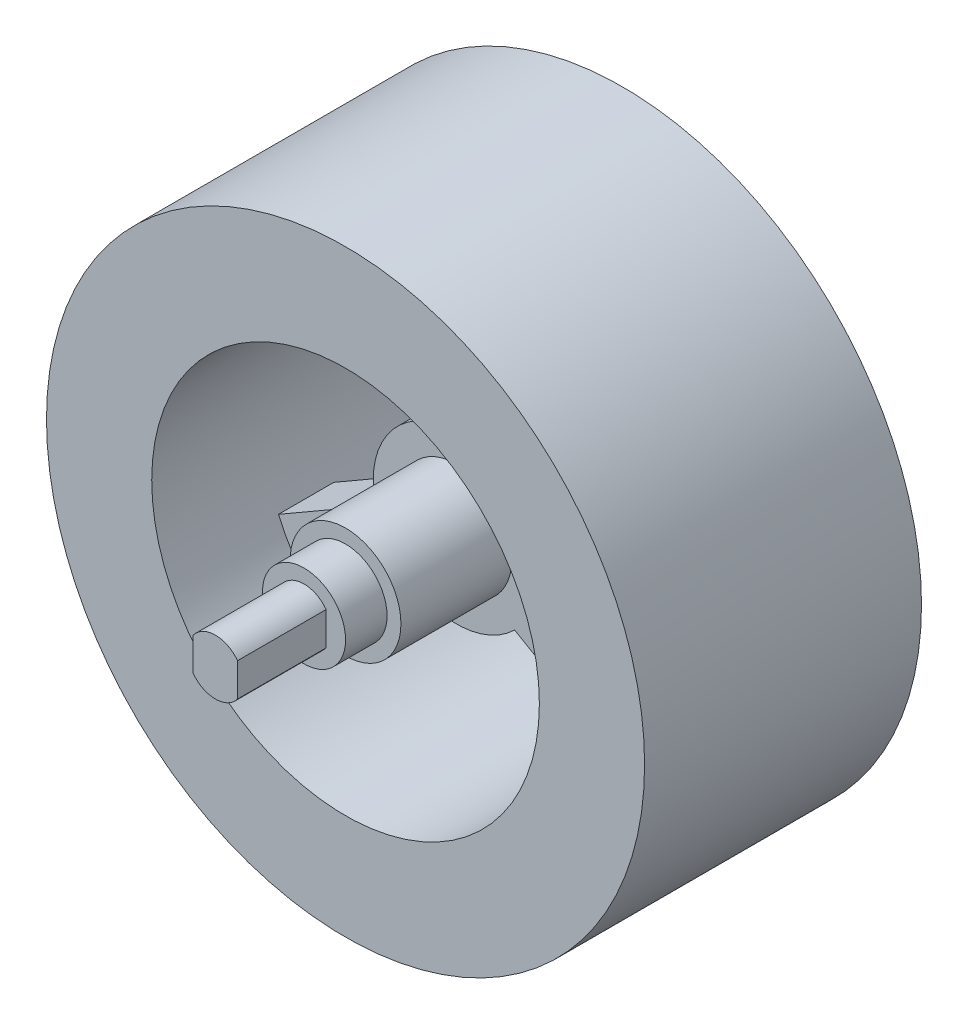
from build123d import *

# Parameters (mm, degrees)
SKETCH1_R           = 7.5
BOSS_EXTRUDE1_DEPTH = 32.5
SKETCH3_R           = 5
BOSS_EXTRUDE3_DEPTH = 48.5
SKETCH4_R           = 54
SKETCH4_R_2         = 35
BOSS_EXTRUDE4_DEPTH = 25
SKETCH5_R           = 15
SKETCH5_W           = 8
SKETCH5_H           = 20.543167705
BOSS_EXTRUDE5_DEPTH = 5
SKETCH6_R           = 10
BOSS_EXTRUDE6_DEPTH = 25
SKETCH7_W           = 1
SKETCH7_H           = 6
CUT_EXTRUDE1_DEPTH  = 16
CUT_EXTRUDE2_START  = -48.5
SKETCH8_R           = 3
CUT_EXTRUDE2_DEPTH  = 48.5


with BuildPart() as part:
    # Sketch1 → Boss-Extrude1 (new, symmetric)
    with BuildSketch(Plane.XY):
        Circle(SKETCH1_R)
    extrude(amount=BOSS_EXTRUDE1_DEPTH, both=True)

    # Sketch3 → Boss-Extrude3 (add, symmetric)
    with BuildSketch(Plane.XY):
        with Locations(Location((0, 0, 0), (0, 0, 180))):
            Circle(SKETCH3_R)
    extrude(amount=BOSS_EXTRUDE3_DEPTH, both=True)



with BuildPart() as body_2:
    # Sketch4 → Boss-Extrude4 (new, symmetric)
    with BuildSketch(Plane.XY):
        Circle(SKETCH4_R)
        Circle(SKETCH4_R_2, mode=Mode.SUBTRACT)
    extrude(amount=BOSS_EXTRUDE4_DEPTH, both=True)


with BuildPart() as part_1:
    add(part.part)

    add(body_2.part)  # Boss-Extrude5 merges body 2
    # Sketch5 → Boss-Extrude5 (add, symmetric)
    with BuildSketch(Plane.XY):
        Circle(SKETCH5_R)
        Polygon((14.519984026, -3.764314532), (10.519984026, -10.692517763), (28.310889132, -20.964101615), (32.310889132, -14.035898385), align=None)
        with Locations((0, 24.728416147)):
            Rectangle(SKETCH5_W, SKETCH5_H)
        Polygon((-10.519984026, -10.692517763), (-14.519984026, -3.764314532), (-32.310889132, -14.035898385), (-28.310889132, -20.964101615), align=None)
    extrude(amount=BOSS_EXTRUDE5_DEPTH, both=True)

    # Sketch6 → Boss-Extrude6 (add, symmetric)
    with BuildSketch(Plane.XY):
        Circle(SKETCH6_R)
    extrude(amount=BOSS_EXTRUDE6_DEPTH, both=True)

    # Sketch7 → Cut-Extrude1 (cut)
    with BuildSketch(Plane(origin=(0, 0, -48.5), x_dir=(-1, 0, 0), z_dir=(0, 0, -1))):
        with Locations((4.5, 0)):
            Rectangle(SKETCH7_W, SKETCH7_H)
        with Locations((-4.5, 0)):
            Rectangle(SKETCH7_W, SKETCH7_H)
    cut_extrude1 = extrude(amount=-CUT_EXTRUDE1_DEPTH, mode=Mode.SUBTRACT)

    # Mirror1: Cut-Extrude1 across plane
    add(cut_extrude1.mirror(Plane.XY), mode=Mode.SUBTRACT)

    # Sketch8 → Cut-Extrude2 (cut)
    with BuildSketch(Plane(origin=(0, 0, -48.5), x_dir=(-1, 0, 0), z_dir=(0, 0, -1)).offset(CUT_EXTRUDE2_START)):
        Circle(SKETCH8_R)
    extrude(amount=CUT_EXTRUDE2_DEPTH, mode=Mode.SUBTRACT)


solid = part_1.part
